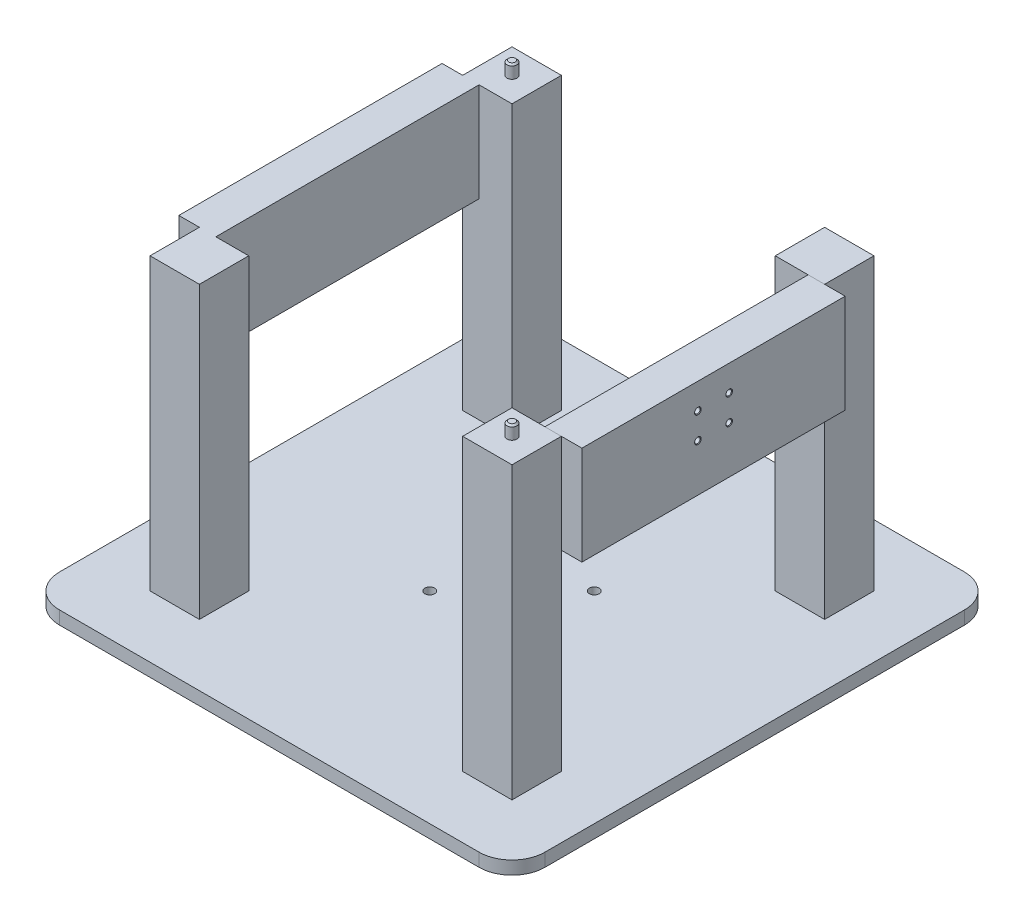
from build123d import *

# Parameters (mm, degrees)
BOSS_EXTRUDE1_DEPTH            = 8
SKETCH3_W                      = 30
SKETCH3_H                      = 30
BOSS_EXTRUDE2_DEPTH            = 176.41
SKETCH5_R                      = 3
BOSS_EXTRUDE3_DEPTH            = 8
SKETCH6_R                      = 3
BOSS_EXTRUDE4_DEPTH            = 8
CHAMFER1_SIZE                  = 1
BOSS_EXTRUDE5_DEPTH            = 12.5
BOSS_EXTRUDE5_DEPTH_BACK       = 10
SKETCH7_W                      = 160
SKETCH7_H                      = 60
BOSS_EXTRUDE6_DEPTH            = 12.5
BOSS_EXTRUDE6_DEPTH_BACK       = 10
SKETCH9_W                      = 160
SKETCH9_H                      = 60
M4X0_7_TAPPED_HOLE1_AT_2_COUNT = 2
M4X0_7_TAPPED_HOLE1_AT_2_PITCH = 15.64
M4X0_7_TAPPED_HOLE1_AT_3_COUNT = 2
M4X0_7_TAPPED_HOLE1_AT_3_PITCH = 19
M4X0_7_TAPPED_HOLE1_AT_4_COUNT = 2
M4X0_7_TAPPED_HOLE1_AT_4_PITCH = 24.609136515
M4X0_7_TAPPED_HOLE2_AT_2_COUNT = 2
M4X0_7_TAPPED_HOLE2_AT_2_PITCH = 16
M4X0_7_TAPPED_HOLE2_AT_3_COUNT = 2
M4X0_7_TAPPED_HOLE2_AT_3_PITCH = 19
M4X0_7_TAPPED_HOLE2_AT_4_COUNT = 2
M4X0_7_TAPPED_HOLE2_AT_4_PITCH = 24.839484697
SKETCH15_R                     = 3
CUT_EXTRUDE1_DEPTH             = 10


with BuildPart() as part:
    # Sketch2 → Boss-Extrude1 (new body)
    with BuildSketch(Plane(origin=(0, 0, 0), x_dir=(1, 0, 0), z_dir=(0, 1, 0))):
        with BuildLine():
            Line((-127.5, -147.5), (127.5, -147.5))
            ThreePointArc((127.5, -147.5), (141.642135624, -141.642135624), (147.5, -127.5))
            Line((147.5, -127.5), (147.5, 127.5))
            ThreePointArc((147.5, 127.5), (141.642135624, 141.642135624), (127.5, 147.5))
            Line((127.5, 147.5), (-127.5, 147.5))
            ThreePointArc((-127.5, 147.5), (-141.642135624, 141.642135624), (-147.5, 127.5))
            Line((-147.5, 127.5), (-147.5, -127.5))
            ThreePointArc((-147.5, -127.5), (-141.642135624, -141.642135624), (-127.5, -147.5))
        make_face()
    extrude(amount=BOSS_EXTRUDE1_DEPTH)

    # Sketch3 → Boss-Extrude2 (add)
    with BuildSketch(Plane(origin=(0, 8, 0), x_dir=(1, 0, 0), z_dir=(0, 1, 0))):
        with Locations((-95, 95)):
            Rectangle(SKETCH3_W, SKETCH3_H)
        with Locations((95, 95)):
            Rectangle(SKETCH3_W, SKETCH3_H)
        with Locations((95, -95)):
            Rectangle(SKETCH3_W, SKETCH3_H)
        with Locations((-95, -95)):
            Rectangle(SKETCH3_W, SKETCH3_H)
    extrude(amount=BOSS_EXTRUDE2_DEPTH)

    # Sketch5 → Boss-Extrude3 (add)
    with BuildSketch(Plane(origin=(0, 184.41, 0), x_dir=(1, 0, 0), z_dir=(0, 1, 0))):
        with Locations((-95, 95)):
            Circle(SKETCH5_R)
    extrude(amount=BOSS_EXTRUDE3_DEPTH)

    # Sketch6 → Boss-Extrude4 (add)
    with BuildSketch(Plane(origin=(0, 184.41, 0), x_dir=(1, 0, 0), z_dir=(0, 1, 0))):
        with Locations((95, -95)):
            Circle(SKETCH6_R)
    extrude(amount=BOSS_EXTRUDE4_DEPTH)

    # Chamfer1
    chamfer1_edges = [part.edges().sort_by_distance(p)[0] for p in [
        (-98, 192.41, -95),
        (92, 192.41, 95),
    ]]
    chamfer(chamfer1_edges, length=CHAMFER1_SIZE)

    # Sketch9 → Boss-Extrude6 (add, two sides: drawn at the far end of the back side and taken through both)
    with BuildSketch(Plane.ZY.offset(110).offset(-BOSS_EXTRUDE6_DEPTH_BACK)):
        with Locations((0, 154.41)):
            Rectangle(SKETCH9_W, SKETCH9_H)
    extrude(amount=BOSS_EXTRUDE6_DEPTH + BOSS_EXTRUDE6_DEPTH_BACK)

    # Sketch14 → M4x0.7 Tapped Hole2 (revolve, cut)
    with BuildSketch(Plane(origin=(-122.5, 168.77, -9.5), x_dir=(0, 0, 1), z_dir=(0, 1, 0))):
        Polygon((0, 0), (0, 11.091420021), (1.65, 10.1), (1.65, 0.314662362), (2.025, 0), align=None)
    m4x0_7_tapped_hole2 = revolve(axis=Axis((-128.85, 168.77, -9.5), (1, 0, 0)), mode=Mode.SUBTRACT)

    # M4x0.7 Tapped Hole2 at 2: M4x0.7 Tapped Hole2 ×2
    with Locations(*[(0, -i * M4X0_7_TAPPED_HOLE2_AT_2_PITCH, 0) for i in range(1, M4X0_7_TAPPED_HOLE2_AT_2_COUNT)]):
        add(m4x0_7_tapped_hole2, mode=Mode.SUBTRACT)

    # M4x0.7 Tapped Hole2 at 3: M4x0.7 Tapped Hole2 ×2
    with Locations(*[(0, 0, i * M4X0_7_TAPPED_HOLE2_AT_3_PITCH) for i in range(1, M4X0_7_TAPPED_HOLE2_AT_3_COUNT)]):
        add(m4x0_7_tapped_hole2, mode=Mode.SUBTRACT)

    # M4x0.7 Tapped Hole2 at 4: M4x0.7 Tapped Hole2 ×2
    with Locations(*[Vector(0, -0.6441357457827805, 0.7649111981170502) * (i * M4X0_7_TAPPED_HOLE2_AT_4_PITCH) for i in range(1, M4X0_7_TAPPED_HOLE2_AT_4_COUNT)]):
        add(m4x0_7_tapped_hole2, mode=Mode.SUBTRACT)

    # Sketch15 → Cut-Extrude1 (cut)
    with BuildSketch(Plane(origin=(0, 8, 0), x_dir=(1, 0, 0), z_dir=(0, 1, 0))):
        with Locations((-25, 25)):
            Circle(SKETCH15_R)
        with Locations((25, 25)):
            Circle(SKETCH15_R)
        with Locations((25, -25)):
            Circle(SKETCH15_R)
        with Locations((-25, -25)):
            Circle(SKETCH15_R)
    extrude(amount=-CUT_EXTRUDE1_DEPTH, mode=Mode.SUBTRACT)


with BuildPart() as body_2:
    # Sketch7 → Boss-Extrude5 (new, two sides: drawn at the far end of the back side and taken through both)
    with BuildSketch(Plane(origin=(110, 0, 0), x_dir=(0, 0, -1), z_dir=(1, 0, 0)).offset(-BOSS_EXTRUDE5_DEPTH_BACK)):
        with Locations((0, 154.41)):
            Rectangle(SKETCH7_W, SKETCH7_H)
    extrude(amount=BOSS_EXTRUDE5_DEPTH + BOSS_EXTRUDE5_DEPTH_BACK)

    # Sketch11 → M4x0.7 Tapped Hole1 (revolve, cut)
    with BuildSketch(Plane(origin=(122.5, 168.71, -9.5), x_dir=(0, 0, -1), z_dir=(0, 1, 0))):
        Polygon((0, 0), (0, 10.991420021), (1.65, 10), (1.65, 0.314662362), (2.025, 0), align=None)
    m4x0_7_tapped_hole1 = revolve(axis=Axis((128.85, 168.71, -9.5), (-1, 0, 0)), mode=Mode.SUBTRACT)

    # M4x0.7 Tapped Hole1 at 2: M4x0.7 Tapped Hole1 ×2
    with Locations(*[(0, -i * M4X0_7_TAPPED_HOLE1_AT_2_PITCH, 0) for i in range(1, M4X0_7_TAPPED_HOLE1_AT_2_COUNT)]):
        add(m4x0_7_tapped_hole1, mode=Mode.SUBTRACT)

    # M4x0.7 Tapped Hole1 at 3: M4x0.7 Tapped Hole1 ×2
    with Locations(*[(0, 0, i * M4X0_7_TAPPED_HOLE1_AT_3_PITCH) for i in range(1, M4X0_7_TAPPED_HOLE1_AT_3_COUNT)]):
        add(m4x0_7_tapped_hole1, mode=Mode.SUBTRACT)

    # M4x0.7 Tapped Hole1 at 4: M4x0.7 Tapped Hole1 ×2
    with Locations(*[Vector(0, -0.6355363176049079, 0.7720709740724577) * (i * M4X0_7_TAPPED_HOLE1_AT_4_PITCH) for i in range(1, M4X0_7_TAPPED_HOLE1_AT_4_COUNT)]):
        add(m4x0_7_tapped_hole1, mode=Mode.SUBTRACT)


solid = Compound([part.part, body_2.part])
